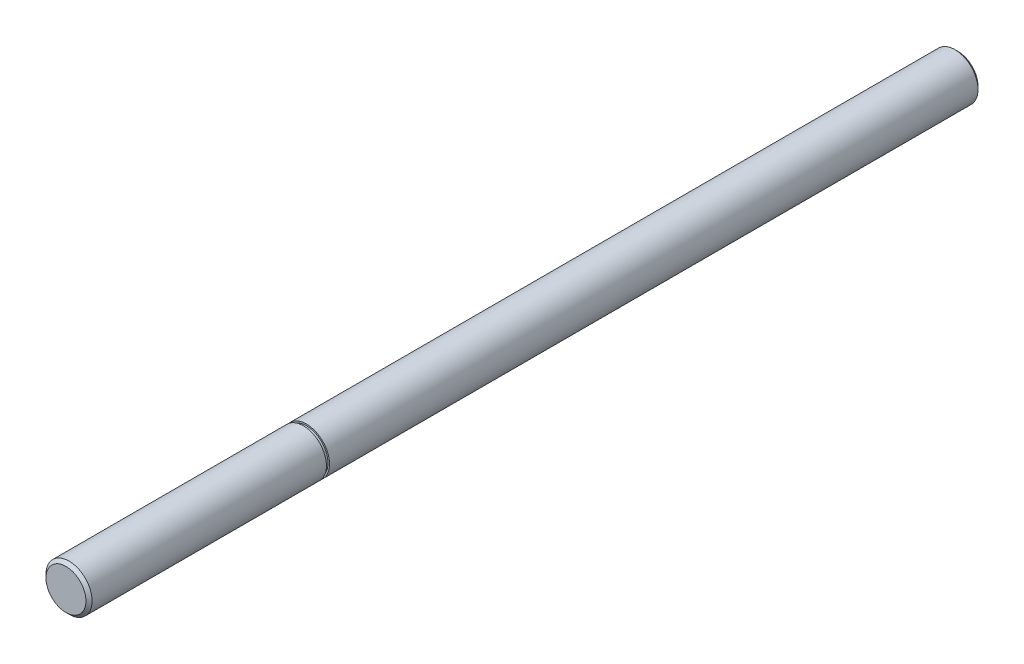
from build123d import *

# Parameters (mm, degrees)
SKETCH1_R           = 7.5
BOSS_EXTRUDE1_DEPTH = 290
CHAMFER1_SIZE       = 1
CUT_EXTRUDE1_START  = -1
SKETCH2_R           = 7.5
SKETCH2_R_2         = 7
CUT_EXTRUDE1_DEPTH  = 1


with BuildPart() as part:
    # Sketch1 → Boss-Extrude1 (new body)
    with BuildSketch(Plane.XY):
        Circle(SKETCH1_R)
    extrude(amount=BOSS_EXTRUDE1_DEPTH)

    # Chamfer1
    chamfer1_edges = [part.edges().sort_by_distance(p)[0] for p in [
        (-7.5, 0, 0),
        (-7.5, 0, 290),
    ]]
    chamfer(chamfer1_edges, length=CHAMFER1_SIZE)

    # Sketch2 → Cut-Extrude1 (cut)
    with BuildSketch(Plane.XY.offset(212.82).offset(CUT_EXTRUDE1_START)):
        Circle(SKETCH2_R)
        Circle(SKETCH2_R_2, mode=Mode.SUBTRACT)
    extrude(amount=CUT_EXTRUDE1_DEPTH, mode=Mode.SUBTRACT)


solid = part.part
